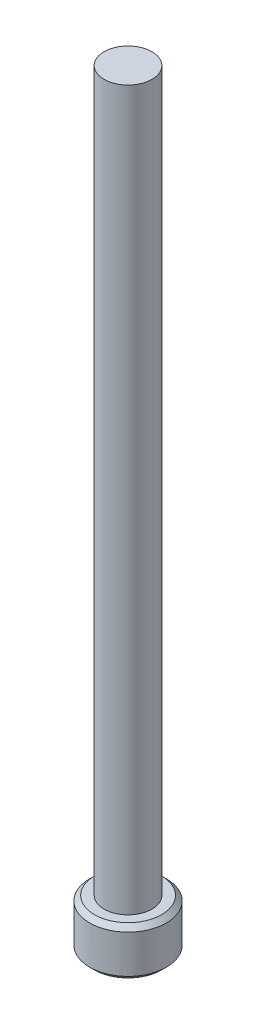
from build123d import *

# Parameters (mm, degrees)
SKETCH1_R           = 2.5
BOSS_EXTRUDE1_DEPTH = 75
SKETCH3_W           = 4
SKETCH3_H           = 5
CUT_EXTRUDE1_START  = -1
CUT_EXTRUDE1_DEPTH  = 30
CHAMFER1_SIZE       = 0.5


with BuildPart() as part:
    # Sketch1 → Boss-Extrude1 (new body)
    with BuildSketch(Plane(origin=(0, 0, 0), x_dir=(1, 0, 0), z_dir=(0, 1, 0))):
        with Locations(Location((0, 0, 0), (0, 0, 270))):
            Circle(SKETCH1_R)
    extrude(amount=BOSS_EXTRUDE1_DEPTH)

    # Sketch3 → Revolve1 (revolve)
    with BuildSketch(Plane.XY, mode=Mode.PRIVATE) as revolve1_sk:
        with Locations((-2, -2.5)):
            Rectangle(SKETCH3_W, SKETCH3_H)
    revolve(revolve1_sk.sketch.rotate(Axis((0, -5, 0), (0, 1, 0)), 270), axis=Axis((0, -5, 0), (0, 1, 0)))

    # Sketch4 → Cut-Extrude1 (cut)
    with BuildSketch(Plane(origin=(0, 0, 0), x_dir=(1, 0, 0), z_dir=(0, 1, 0)).offset(CUT_EXTRUDE1_START)):
        Polygon((2.886751346, 0), (1.443375673, 2.5), (-1.443375673, 2.5), (-2.886751346, 0), (-1.443375673, -2.5), (1.443375673, -2.5), align=None)
    extrude(amount=-CUT_EXTRUDE1_DEPTH, mode=Mode.SUBTRACT)

    # Chamfer1
    chamfer1_edges = [part.edges().sort_by_distance(p)[0] for p in [
        (0, 0, 4),
        (0, -5, 4),
    ]]
    chamfer(chamfer1_edges, length=CHAMFER1_SIZE)


solid = part.part
